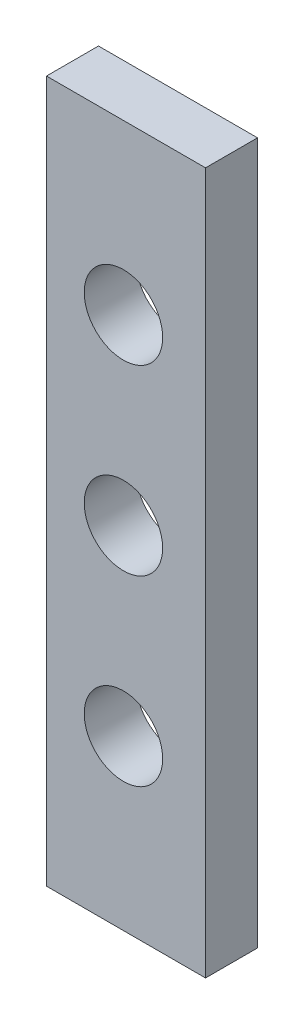
from build123d import *

# Parameters (mm, degrees)
SKETCH_1_W                = 8.718422396
SKETCH_1_H                = 38.462613559
EXTRUDE_1_DEPTH           = 2.850000001
HOLE_WIZARD_1_D           = 4.3
HOLE_WIZARD_1_DEPTH       = 19
HOLE_WIZARD_1_CSINK_D     = 8
HOLE_WIZARD_1_CSINK_ANGLE = 90
HOLE_WIZARD_1_TIP         = 1.291850331


with BuildPart() as part:
    # 草图1 → 凸台-拉伸1 (new body)
    with BuildSketch(Plane.XY):
        with Locations((-125.640788802, -85.768693221)):
            Rectangle(SKETCH_1_W, SKETCH_1_H)
    extrude(amount=EXTRUDE_1_DEPTH)

    # 打孔尺寸(%根据十字)槽沉头木螺钉的类型1
    with Locations(Plane(origin=(40.491378875, -131.010130877, 7.000000001), x_dir=(0, 1, 0), z_dir=(0, 0, 1))):
        with Locations((35.241437657, 166.27295648), (45.241437657, 166.27295648), (55.241437657, 166.27295648), (206.778824098, 166.27295648), (216.778824098, 166.27295648), (226.778824098, 166.27295648)):
            CounterSinkHole(HOLE_WIZARD_1_D / 2, HOLE_WIZARD_1_CSINK_D / 2, depth=HOLE_WIZARD_1_DEPTH, counter_sink_angle=HOLE_WIZARD_1_CSINK_ANGLE)
            with Locations((0, 0, -(HOLE_WIZARD_1_DEPTH + HOLE_WIZARD_1_TIP / 2))):  # 118° drill point
                Cone(0, HOLE_WIZARD_1_D / 2, HOLE_WIZARD_1_TIP, mode=Mode.SUBTRACT)


solid = part.part
